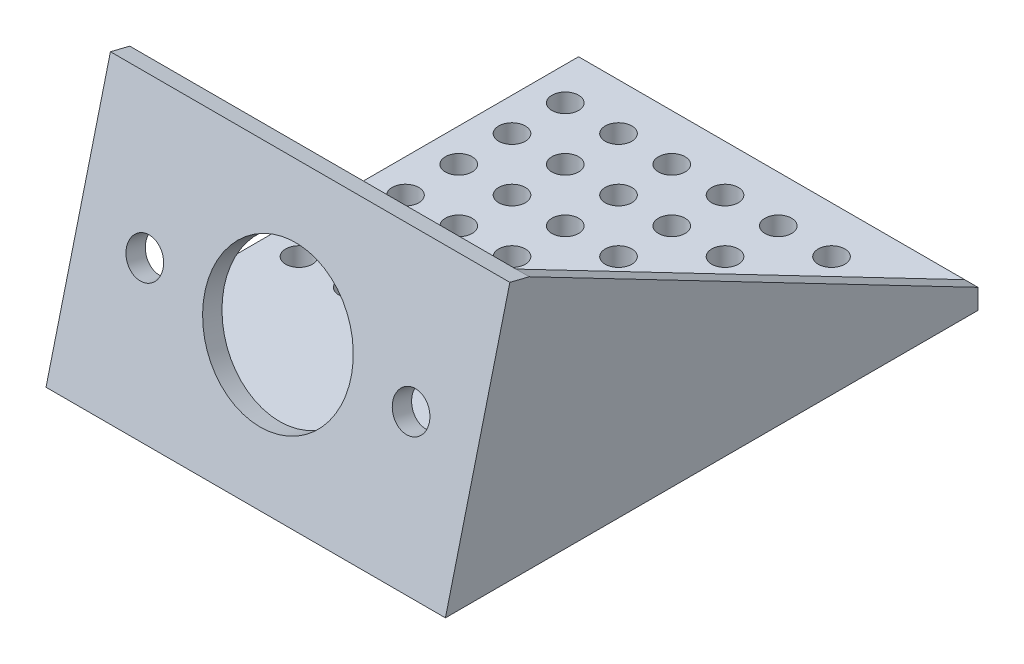
from build123d import *

# Parameters (mm, degrees)
BOSS_EXTRUDE1_DEPTH = 2
BOSS_EXTRUDE2_DEPTH = 60
CUT_EXTRUDE1_REACH  = 109.268
SKETCH2_R           = 11
SKETCH2_R_2         = 2.75
SKETCH3_R           = 2
CUT_EXTRUDE2_DEPTH  = 3
FILLET1_R           = 4


with BuildPart() as part:
    # Sketch1 → Boss-Extrude1 (new body)
    with BuildSketch(Plane(origin=(0, 0, 0), x_dir=(0, 0, -1), z_dir=(1, 0, 0))):
        Polygon((12.587763003, 38.086063364), (80, 3), (3.839824897, 3), align=None)
        Polygon((9.676875824, 38.811829051), (12.587763003, 38.086063364), (3.839824897, 3), (80, 3), (80, 0), (0, 0), align=None)
    extrude(amount=-BOSS_EXTRUDE1_DEPTH)

    # Sketch1<3> → Boss-Extrude2 (add)
    with BuildSketch(Plane(origin=(0, 0, 0), x_dir=(0, 0, -1), z_dir=(1, 0, 0))):
        Polygon((9.676875824, 38.811829051), (12.587763003, 38.086063364), (3.839824897, 3), (80, 3), (80, 0), (0, 0), align=None)
    extrude(amount=-BOSS_EXTRUDE2_DEPTH)

    # Sketch2 → Cut-Extrude1 (cut, up to next)
    with BuildSketch(Plane(origin=(0, 0, 0), x_dir=(1, 0, 0), z_dir=(0, 0.24192189559967164, 0.9702957262759956)), mode=Mode.PRIVATE) as cut_extrude1_sk1:
        with Locations(Location((-30, 20, 0), (0, 0, 270))):
            Circle(SKETCH2_R)
    cut_extrude1_tool1 = extrude(cut_extrude1_sk1.sketch, amount=-CUT_EXTRUDE1_REACH, mode=Mode.PRIVATE) & part.part
    # Sketch2 → Cut-Extrude1 (cut, up to next)
    with BuildSketch(Plane(origin=(0, 0, 0), x_dir=(1, 0, 0), z_dir=(0, 0.24192189559967164, 0.9702957262759956)), mode=Mode.PRIVATE) as cut_extrude1_sk2:
        with Locations(Location((-50, 20, 0), (0, 0, 270))):
            Circle(SKETCH2_R_2)
    cut_extrude1_tool2 = extrude(cut_extrude1_sk2.sketch, amount=-CUT_EXTRUDE1_REACH, mode=Mode.PRIVATE) & part.part
    # Sketch2 → Cut-Extrude1 (cut, up to next)
    with BuildSketch(Plane(origin=(0, 0, 0), x_dir=(1, 0, 0), z_dir=(0, 0.24192189559967164, 0.9702957262759956)), mode=Mode.PRIVATE) as cut_extrude1_sk3:
        with Locations(Location((-10, 20, 0), (0, 0, 90))):
            Circle(SKETCH2_R_2)
    cut_extrude1_tool3 = extrude(cut_extrude1_sk3.sketch, amount=-CUT_EXTRUDE1_REACH, mode=Mode.PRIVATE) & part.part
    add(cut_extrude1_tool1.solids().sort_by_distance((-30, 19.405915, -4.838438))[0], mode=Mode.SUBTRACT)
    add(cut_extrude1_tool2.solids().sort_by_distance((-50, 19.405915, -4.838438))[0], mode=Mode.SUBTRACT)
    add(cut_extrude1_tool3.solids().sort_by_distance((-10, 19.405915, -4.838438))[0], mode=Mode.SUBTRACT)

    # Sketch3 → Cut-Extrude2 (cut)
    with BuildSketch(Plane.XZ):
        with Locations(Location((-55, -33, 0), (0, 0, 270))):
            Circle(SKETCH3_R)
        with Locations(Location((-47, -33, 0), (0, 0, 270))):
            Circle(SKETCH3_R)
        with Locations(Location((-39, -33, 0), (0, 0, 270))):
            Circle(SKETCH3_R)
        with Locations(Location((-31, -33, 0), (0, 0, 270))):
            Circle(SKETCH3_R)
        with Locations(Location((-23, -33, 0), (0, 0, 270))):
            Circle(SKETCH3_R)
        with Locations(Location((-15, -33, 0), (0, 0, 270))):
            Circle(SKETCH3_R)
        with Locations(Location((-47, -41, 0), (0, 0, 270))):
            Circle(SKETCH3_R)
        with Locations(Location((-39, -41, 0), (0, 0, 270))):
            Circle(SKETCH3_R)
        with Locations(Location((-31, -41, 0), (0, 0, 270))):
            Circle(SKETCH3_R)
        with Locations(Location((-23, -41, 0), (0, 0, 270))):
            Circle(SKETCH3_R)
        with Locations(Location((-15, -41, 0), (0, 0, 270))):
            Circle(SKETCH3_R)
        with Locations(Location((-47, -49, 0), (0, 0, 270))):
            Circle(SKETCH3_R)
        with Locations(Location((-39, -49, 0), (0, 0, 270))):
            Circle(SKETCH3_R)
        with Locations(Location((-31, -49, 0), (0, 0, 270))):
            Circle(SKETCH3_R)
        with Locations(Location((-23, -49, 0), (0, 0, 270))):
            Circle(SKETCH3_R)
        with Locations(Location((-15, -49, 0), (0, 0, 270))):
            Circle(SKETCH3_R)
        with Locations(Location((-47, -57, 0), (0, 0, 270))):
            Circle(SKETCH3_R)
        with Locations(Location((-39, -57, 0), (0, 0, 270))):
            Circle(SKETCH3_R)
        with Locations(Location((-31, -57, 0), (0, 0, 270))):
            Circle(SKETCH3_R)
        with Locations(Location((-23, -57, 0), (0, 0, 270))):
            Circle(SKETCH3_R)
        with Locations(Location((-15, -57, 0), (0, 0, 270))):
            Circle(SKETCH3_R)
        with Locations(Location((-47, -65, 0), (0, 0, 270))):
            Circle(SKETCH3_R)
        with Locations(Location((-39, -65, 0), (0, 0, 270))):
            Circle(SKETCH3_R)
        with Locations(Location((-31, -65, 0), (0, 0, 270))):
            Circle(SKETCH3_R)
        with Locations(Location((-23, -65, 0), (0, 0, 270))):
            Circle(SKETCH3_R)
        with Locations(Location((-15, -65, 0), (0, 0, 270))):
            Circle(SKETCH3_R)
        with Locations(Location((-47, -73, 0), (0, 0, 270))):
            Circle(SKETCH3_R)
        with Locations(Location((-39, -73, 0), (0, 0, 270))):
            Circle(SKETCH3_R)
        with Locations(Location((-31, -73, 0), (0, 0, 270))):
            Circle(SKETCH3_R)
        with Locations(Location((-23, -73, 0), (0, 0, 270))):
            Circle(SKETCH3_R)
        with Locations(Location((-15, -73, 0), (0, 0, 270))):
            Circle(SKETCH3_R)
        with Locations(Location((-55, -41, 0), (0, 0, 270))):
            Circle(SKETCH3_R)
        with Locations(Location((-55, -49, 0), (0, 0, 270))):
            Circle(SKETCH3_R)
        with Locations(Location((-55, -57, 0), (0, 0, 270))):
            Circle(SKETCH3_R)
        with Locations(Location((-55, -65, 0), (0, 0, 270))):
            Circle(SKETCH3_R)
        with Locations(Location((-55, -73, 0), (0, 0, 270))):
            Circle(SKETCH3_R)
    extrude(amount=-CUT_EXTRUDE2_DEPTH, mode=Mode.SUBTRACT)

    # Fillet1
    fillet1_edges = [part.edges().sort_by_distance(p)[0] for p in [
        (-31, 3, -3.839824897),
    ]]
    fillet(fillet1_edges, radius=FILLET1_R)


solid = part.part
